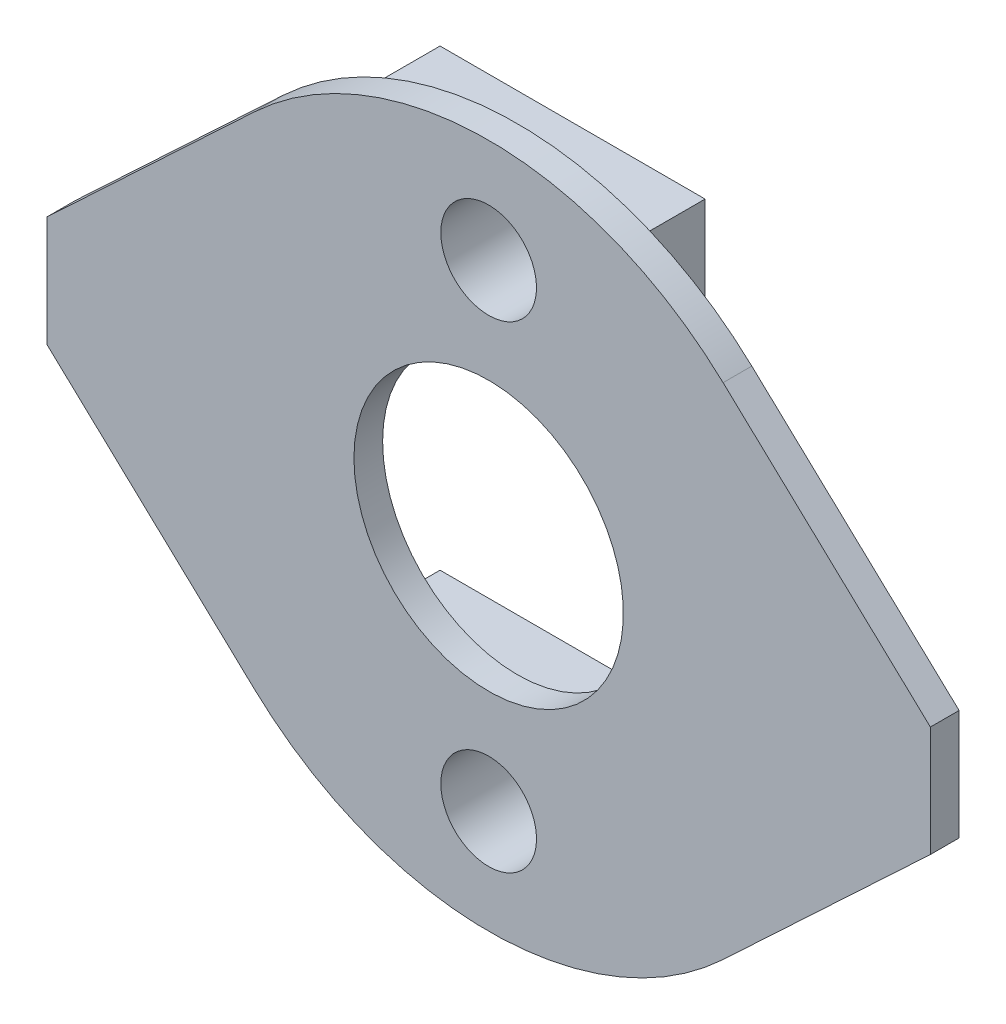
from build123d import *

# Parameters (mm, degrees)
SKETCH1_R           = 7.747
SKETCH1_R_2         = 2.75
BOSS_EXTRUDE1_DEPTH = 1.65
BOSS_EXTRUDE3_START = 3.175
SKETCH2_W           = 15.24
SKETCH2_H           = 10.22657696
SKETCH2_R           = 2.75
BOSS_EXTRUDE3_DEPTH = 3.175


with BuildPart() as part:
    # Sketch1 → Boss-Extrude1 (new body)
    with BuildSketch(Plane.XY):
        with BuildLine():
            Line((43.669801091, 23.910175431), (31.75, 12.722643302))
            Line((31.75, 12.722643302), (31.75, 6.372643302))
            Line((31.75, 6.372643302), (43.669801091, -4.814888828))
            ThreePointArc((43.669801091, -4.814888828), (49.901216852, -8.767739159), (57.15, -10.150023865))
            ThreePointArc((57.15, -10.150023865), (64.398783148, -8.767739159), (70.630198909, -4.814888828))
            Line((70.630198909, -4.814888828), (82.55, 6.372643302))
            Line((82.55, 6.372643302), (82.55, 12.722643302))
            Line((82.55, 12.722643302), (70.630198909, 23.910175431))
            ThreePointArc((70.630198909, 23.910175431), (57.15, 29.245310468), (43.669801091, 23.910175431))
        make_face()
        with BuildLine():
            ThreePointArc((57.15, -1.424690282), (59.9, -4.174690282), (57.15, -6.924690282))
            ThreePointArc((57.15, -6.924690282), (54.4, -4.174690282), (57.15, -1.424690282))
        make_face(mode=Mode.SUBTRACT)
        with Locations(Location((57.15, 9.547643302, 0), (0, 0, 180))):
            Circle(SKETCH1_R, mode=Mode.SUBTRACT)
        with Locations(Location((57.15, 23.269976885, 0), (0, 0, 180))):
            Circle(SKETCH1_R_2, mode=Mode.SUBTRACT)
    extrude(amount=BOSS_EXTRUDE1_DEPTH)

    # Sketch2 → Boss-Extrude3 (add)
    # profile 1 of 2: a face of its own
    with BuildSketch(Plane(origin=(0, 0, 0), x_dir=(-1, 0, 0), z_dir=(0, 0, -1)).offset(BOSS_EXTRUDE3_START)):
        with Locations((-57.15, 22.598431782)):
            Rectangle(SKETCH2_W, SKETCH2_H)
        with Locations((-57.15, 23.269976885)):
            Circle(SKETCH2_R, mode=Mode.SUBTRACT)
    # profile 2 of 2: a face of its own
    with BuildSketch(Plane(origin=(0, 0, 0), x_dir=(-1, 0, 0), z_dir=(0, 0, -1)).offset(BOSS_EXTRUDE3_START)):
        with Locations((-57.15, -3.503145178)):
            Rectangle(SKETCH2_W, SKETCH2_H)
        with Locations((-57.15, -4.174690282)):
            Circle(SKETCH2_R, mode=Mode.SUBTRACT)
    extrude(amount=-BOSS_EXTRUDE3_DEPTH)


solid = part.part
